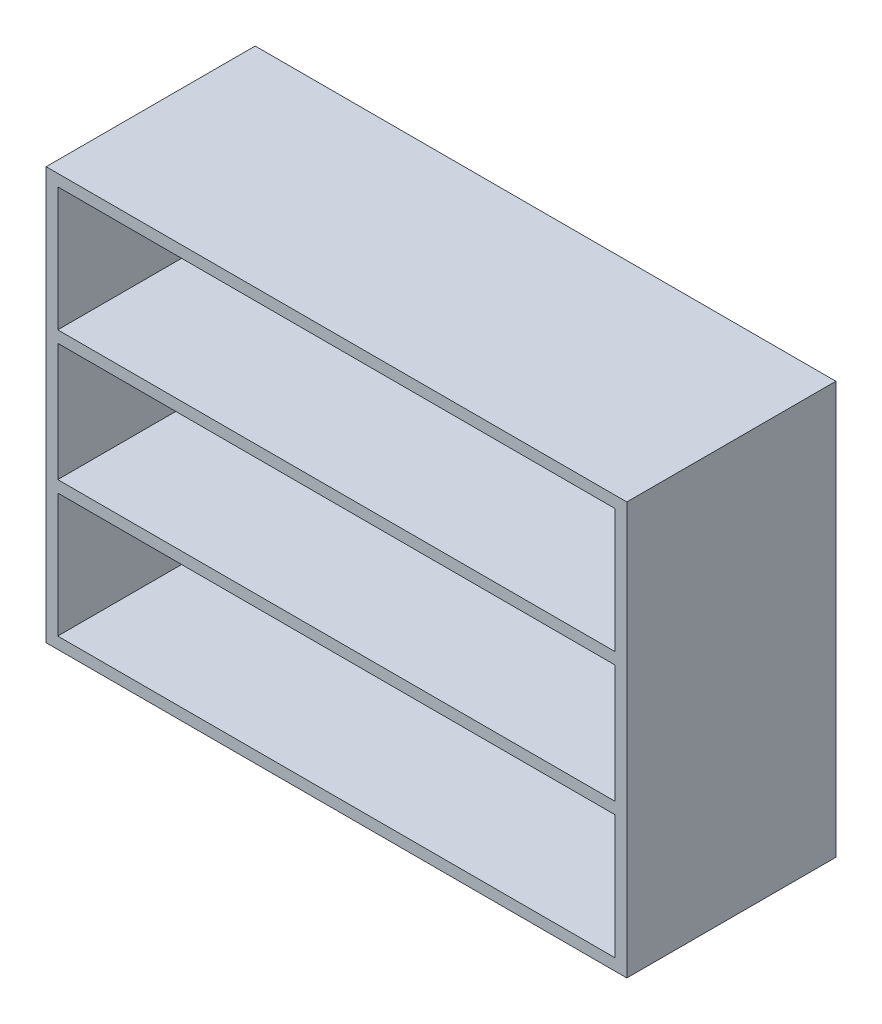
from build123d import *

# Parameters (mm, degrees)
SKETCH1_W           = 2540
SKETCH1_H           = 914.4
BOSS_EXTRUDE1_DEPTH = 1803.4
SKETCH2_W           = 2438.4
SKETCH2_H           = 541.866666667
SKETCH2_H_2         = 516.466666666
CUT_EXTRUDE1_DEPTH  = 2388.735102561


with BuildPart() as part:
    # Sketch1 → Boss-Extrude1 (new body)
    with BuildSketch(Plane(origin=(0, 0, 0), x_dir=(1, 0, 0), z_dir=(0, 1, 0))):
        Rectangle(SKETCH1_W, SKETCH1_H)
    extrude(amount=BOSS_EXTRUDE1_DEPTH)

    # Sketch2 → Cut-Extrude1 (cut, through all)
    with BuildSketch(Plane.XY.offset(457.2)):
        with Locations((0, 321.733333334)):
            Rectangle(SKETCH2_W, SKETCH2_H)
        with Locations((0, 1481.666666667)):
            Rectangle(SKETCH2_W, SKETCH2_H)
        with Locations((0, 901.7)):
            Rectangle(SKETCH2_W, SKETCH2_H_2)
    extrude(amount=-CUT_EXTRUDE1_DEPTH, mode=Mode.SUBTRACT)


solid = part.part
